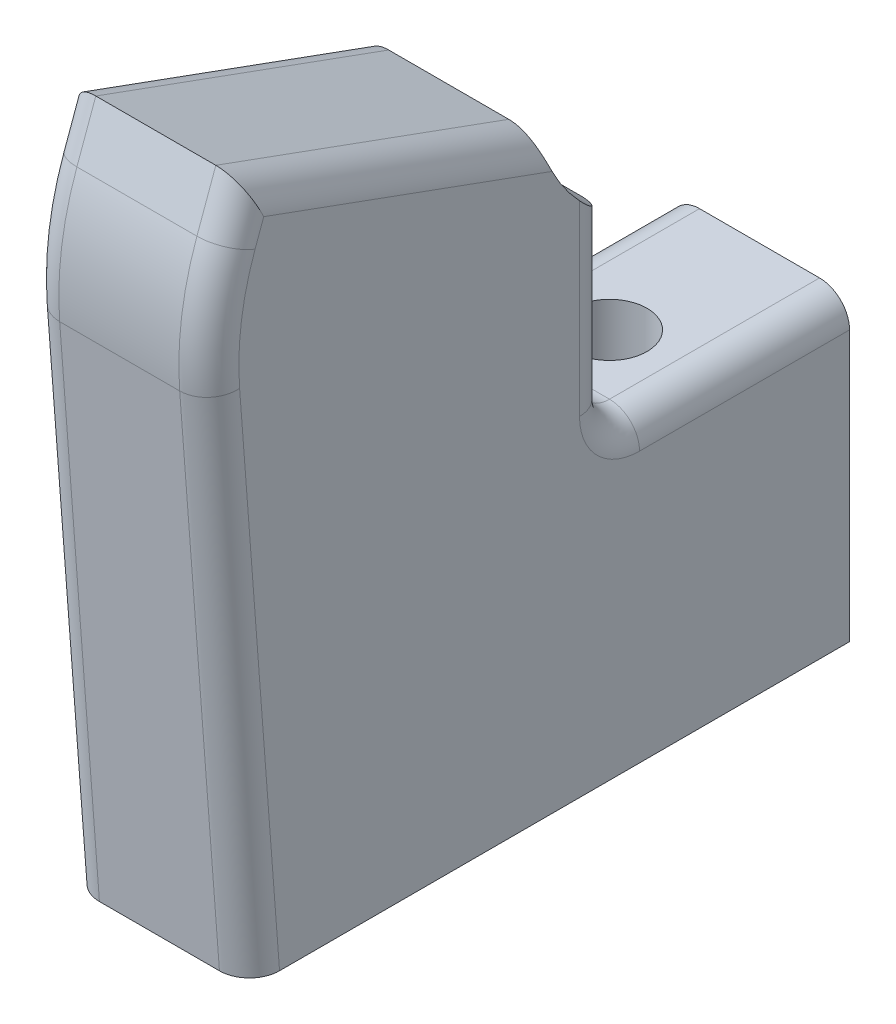
from build123d import *

# Parameters (mm, degrees)
BOSS_EXTRU_1_DEPTH      = 3
CONG_1_R                = 10
CONG_2_R                = 1
CONG_3_R                = 1
ESQUISSE2_R             = 1.25
ENL_V_MAT_EXTRU_1_DEPTH = 26.341724021


with BuildPart() as part:
    # Esquisse1 → Boss.-Extru.1 (new, symmetric)
    with BuildSketch(Plane(origin=(0, 0, 0), x_dir=(0, 0, -1), z_dir=(1, 0, 0))):
        with BuildLine():
            Line((0, 0), (0, 10))
            Line((0, 10), (-8, 10))
            Line((-8, 10), (-8, 16.390227771))
            ThreePointArc((-8, 16.390227771), (-9.505336244, 17.8453296), (-10.357829377, 19.757557096))
            Line((-10.357829377, 19.757557096), (-20.121449742, 23.311224288))
            Line((-20.121449742, 23.311224288), (-21.489530315, 19.552453804))
            Line((-21.489530315, 19.552453804), (-20, 0))
            Line((-20, 0), (0, 0))
        make_face()
    extrude(amount=BOSS_EXTRU_1_DEPTH, both=True)

    # Congé1
    cong_1_edges = [part.edges().sort_by_distance(p)[0] for p in [
        (0, 19.552453804, 21.489530315),
    ]]
    fillet(cong_1_edges, radius=CONG_1_R)

    # Congé2
    cong_2_edges = [part.edges().sort_by_distance(p)[0] for p in [
        (0, 10, 8),
    ]]
    fillet(cong_2_edges, radius=CONG_2_R)

    # Congé3
    cong_3_edges = [part.edges().sort_by_distance(p)[0] for p in [
        (-3, 10, 3.5),
        (3, 21.534390692, 15.239639559),
        (3, 22.445813748, 20.436433419),
        (-3, 8.700295175, 20.662799337),
        (3, 8.700295175, 20.662799337),
        (-3, 19.521122757, 21.261452787),
        (3, 19.521122757, 21.261452787),
        (-3, 13.695113886, 8),
        (3, 13.695113886, 8),
        (-3, 10.292893219, 7.707106781),
        (3, 10.292893219, 7.707106781),
        (3, 10, 3.5),
        (-3, 22.445813748, 20.436433419),
        (-3, 21.534390692, 15.239639559),
    ]]
    fillet(cong_3_edges, radius=CONG_3_R)

    # Esquisse2 → Enlèv. mat.-Extru.1 (cut, through all)
    with BuildSketch(Plane(origin=(0, 10, 0), x_dir=(1, 0, 0), z_dir=(0, 1, 0))):
        with Locations(Location((0, -5, 0), (0, 0, 270))):
            Circle(ESQUISSE2_R)
    extrude(amount=-ENL_V_MAT_EXTRU_1_DEPTH, mode=Mode.SUBTRACT)


solid = part.part
